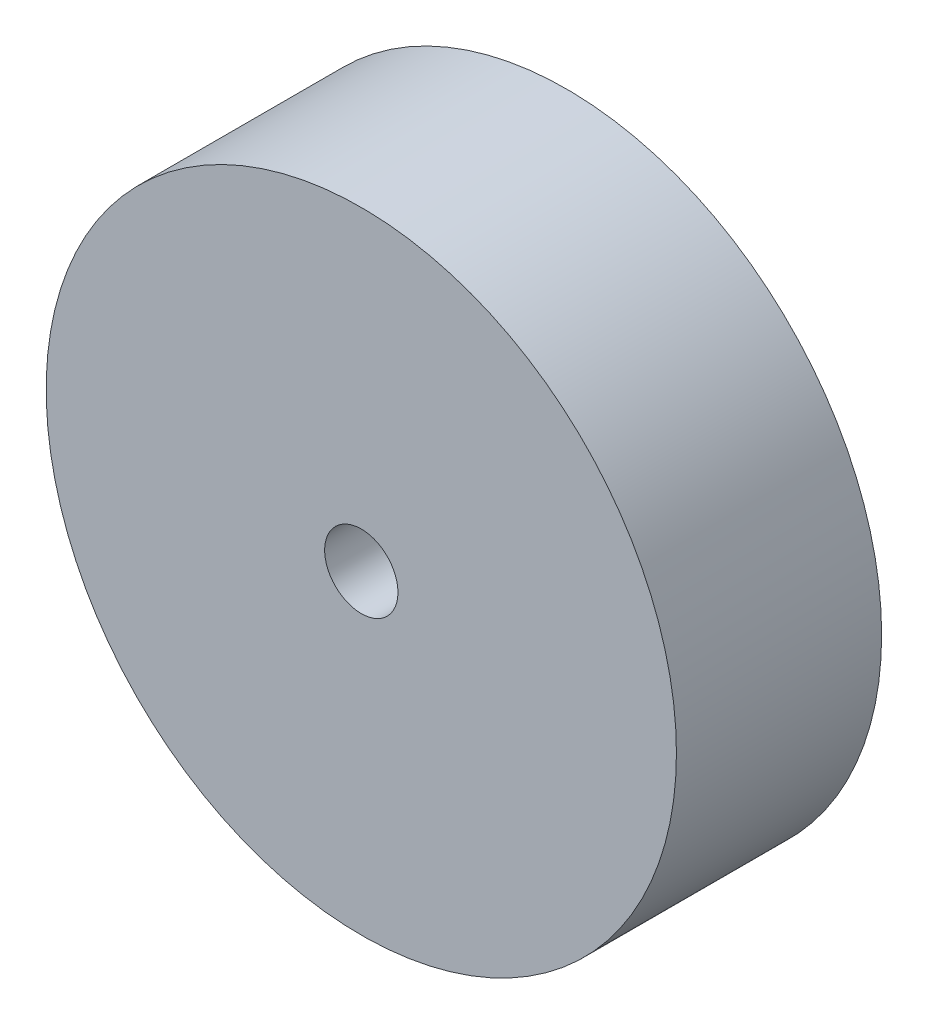
from build123d import *

# Parameters (mm, degrees)
SKETCH1_R           = 21.5
SKETCH1_R_2         = 2.5
BOSS_EXTRUDE1_DEPTH = 14


with BuildPart() as part:
    # Sketch1 → Boss-Extrude1 (new body)
    with BuildSketch(Plane.XY):
        Circle(SKETCH1_R)
        Circle(SKETCH1_R_2, mode=Mode.SUBTRACT)
    extrude(amount=BOSS_EXTRUDE1_DEPTH)


solid = part.part
